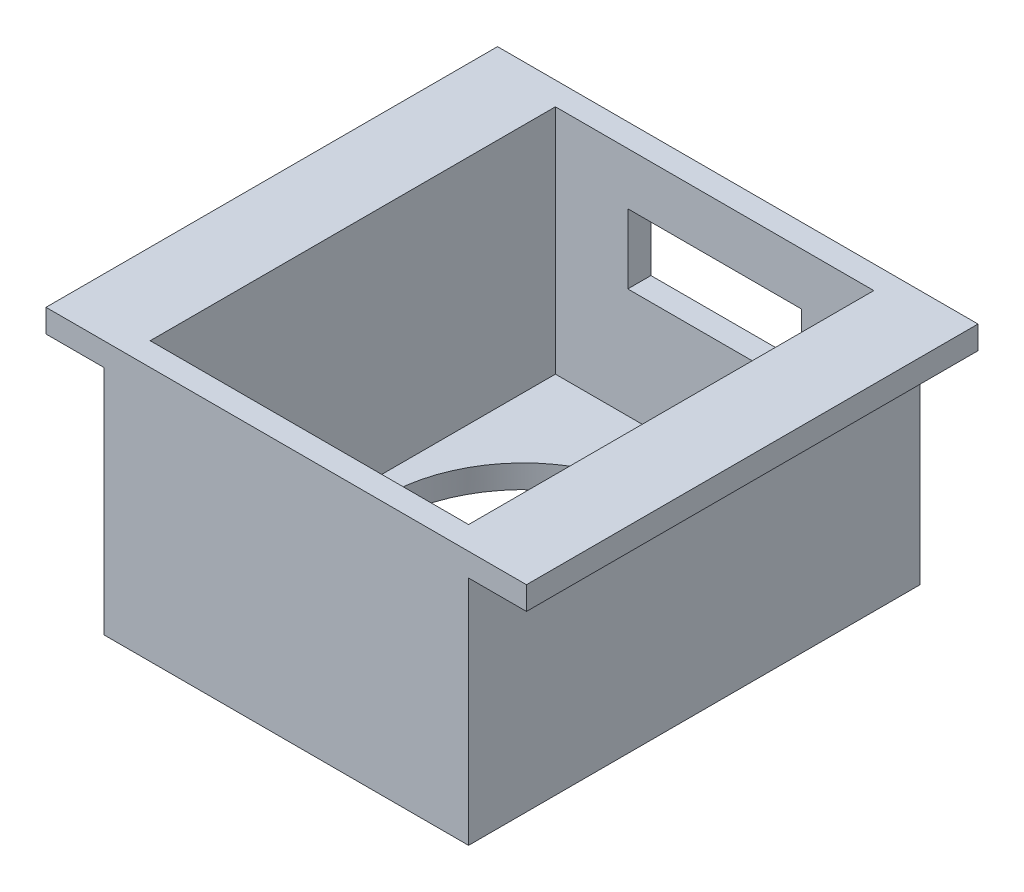
from build123d import *

# Parameters (mm, degrees)
BOSS_EXTRUDE1_DEPTH = 37
BOSS_EXTRUDE2_DEPTH = 2
BOSS_EXTRUDE3_START = -35
BOSS_EXTRUDE3_DEPTH = 2
CUT_EXTRUDE2_DEPTH  = 2
SKETCH8_W           = 15
SKETCH8_H           = 6
SKETCH8_W_2         = 12
SKETCH8_H_2         = 3
CUT_EXTRUDE3_DEPTH  = 10
SKETCH3_R           = 12
CUT_EXTRUDE4_DEPTH  = 10


with BuildPart() as part:
    # Sketch2 → Boss-Extrude1 (new body)
    with BuildSketch(Plane.XY):
        Polygon((0, 0), (7, 0), (7, -20), (34.5, -20), (34.5, 0), (41.5, 0), (41.5, -2), (36.5, -2), (36.5, -22), (5, -22), (5, -2), (0, -2), align=None)
    extrude(amount=BOSS_EXTRUDE1_DEPTH)

    # Sketch5 → Boss-Extrude2 (add)
    with BuildSketch(Plane.XY.offset(37)):
        Polygon((0, 0), (41.5, 0), (41.5, -2), (36.5, -2), (36.5, -22), (5, -22), (5, -2), (0, -2), align=None)
    extrude(amount=BOSS_EXTRUDE2_DEPTH)

    # Sketch5<2> → Boss-Extrude3 (add)
    with BuildSketch(Plane.XY.offset(37).offset(BOSS_EXTRUDE3_START)):
        Polygon((0, 0), (41.5, 0), (41.5, -2), (36.5, -2), (36.5, -22), (5, -22), (5, -2), (0, -2), align=None)
    extrude(amount=-BOSS_EXTRUDE3_DEPTH)

    # Sketch6 → Cut-Extrude2 (cut)
    with BuildSketch(Plane(origin=(0, 0, 0), x_dir=(-1, 0, 0), z_dir=(0, 0, -1))):
        Polygon((-20.75, -9), (-14.75, -9), (-14.75, -6), (-26.75, -6), (-26.75, -9), align=None)
    extrude(amount=-CUT_EXTRUDE2_DEPTH, mode=Mode.SUBTRACT)

    # Sketch8 → Cut-Extrude3 (cut)
    with BuildSketch(Plane(origin=(0, 0, 0), x_dir=(-1, 0, 0), z_dir=(0, 0, -1))):
        with Locations((-20.75, -7.5)):
            Rectangle(SKETCH8_W, SKETCH8_H)
        with Locations((-20.75, -7.5)):
            Rectangle(SKETCH8_W_2, SKETCH8_H_2, mode=Mode.SUBTRACT)
    extrude(amount=-CUT_EXTRUDE3_DEPTH, mode=Mode.SUBTRACT)

    # Sketch3 → Cut-Extrude4 (cut)
    with BuildSketch(Plane.XZ.offset(22)):
        with Locations((20.75, 18.5)):
            Circle(SKETCH3_R)
    extrude(amount=-CUT_EXTRUDE4_DEPTH, mode=Mode.SUBTRACT)


solid = part.part
